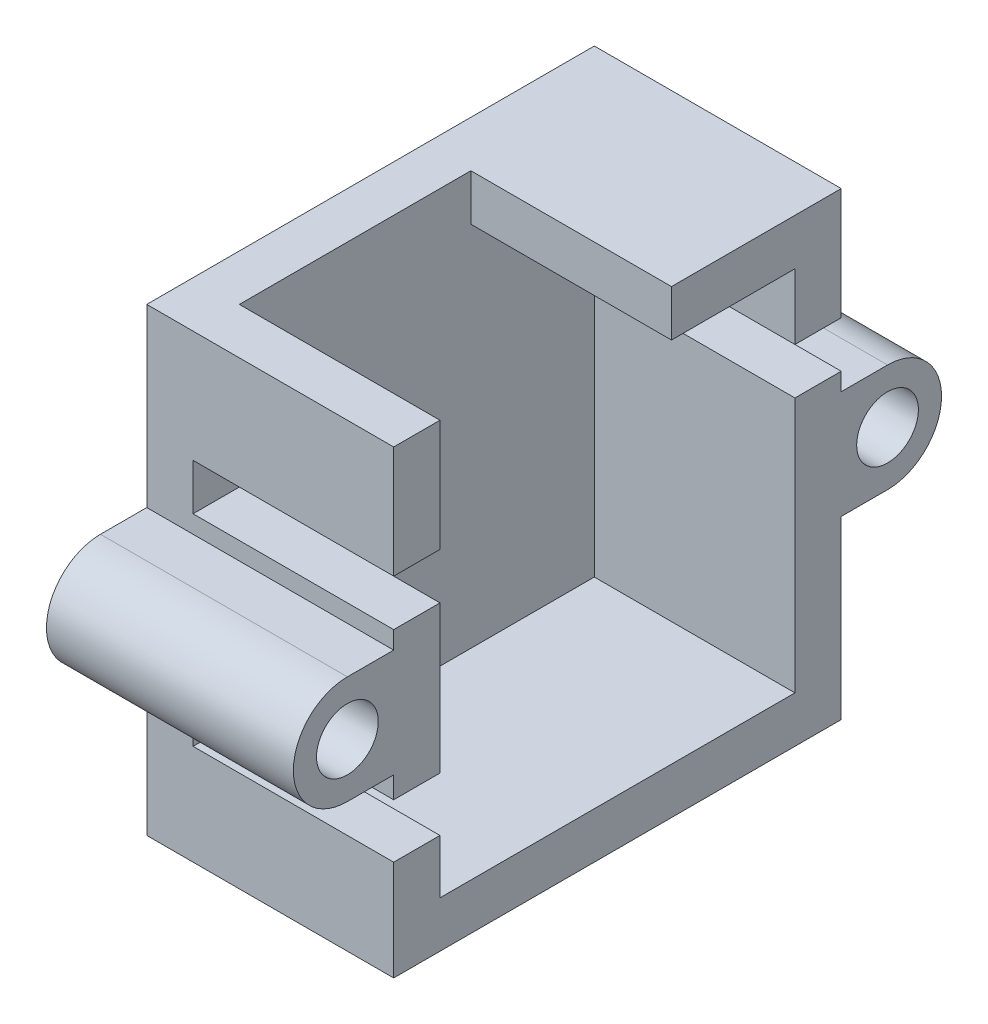
from build123d import *

# Parameters (mm, degrees)
SKETCH1_W                = 29
SKETCH1_H                = 29.8
SKETCH1_W_2              = 23
SKETCH1_H_2              = 23.8
SIDES_DEPTH              = 13
SKETCH2_W                = 29
SKETCH2_H                = 29.8
BASE_DEPTH               = 3
SKETCH3_W                = 29
SKETCH3_H                = 3
SERVO_WING_SLOTS_DEPTH   = 13
SKETCH4_W                = 3
SKETCH4_H                = 3.5
SERVO_WIRE_SLOT_DEPTH    = 13
SKETCH5_W                = 15
SKETCH5_H                = 3
SERVO_HEAD_OPENING_DEPTH = 13
MOUNT_REACH              = 41.538
SKETCH6_R                = 2
MOUNT_DIRECTION_2_REACH  = 41.538


with BuildPart() as part:
    # Sketch1 → sides (new body)
    with BuildSketch(Plane(origin=(0, 0, 0), x_dir=(0, 0, -1), z_dir=(1, 0, 0))):
        with Locations((11.5, 11.9)):
            Rectangle(SKETCH1_W, SKETCH1_H)
        with Locations((11.5, 11.9)):
            Rectangle(SKETCH1_W_2, SKETCH1_H_2, mode=Mode.SUBTRACT)
    extrude(amount=SIDES_DEPTH)

    # Sketch2 → base (add)
    with BuildSketch(Plane(origin=(0, 0, 0), x_dir=(0, 0, -1), z_dir=(1, 0, 0))):
        with Locations((11.5, 11.9)):
            Rectangle(SKETCH2_W, SKETCH2_H)
    extrude(amount=-BASE_DEPTH)

    # Sketch3 → servo wing slots (cut)
    with BuildSketch(Plane(origin=(0, 0, 0), x_dir=(0, 0, -1), z_dir=(1, 0, 0))):
        with Locations((11.5, 18.05)):
            Rectangle(SKETCH3_W, SKETCH3_H)
    extrude(amount=SERVO_WING_SLOTS_DEPTH, mode=Mode.SUBTRACT)

    # Sketch4 → servo wire slot (cut)
    with BuildSketch(Plane(origin=(0, 0, 0), x_dir=(0, 0, -1), z_dir=(1, 0, 0))):
        with Locations((-1.5, 5.25)):
            Rectangle(SKETCH4_W, SKETCH4_H)
    extrude(amount=SERVO_WIRE_SLOT_DEPTH, mode=Mode.SUBTRACT)

    # Sketch5 → servo head opening (cut)
    with BuildSketch(Plane(origin=(0, 0, 0), x_dir=(0, 0, -1), z_dir=(1, 0, 0))):
        with Locations((7.5, 25.3)):
            Rectangle(SKETCH5_W, SKETCH5_H)
    extrude(amount=SERVO_HEAD_OPENING_DEPTH, mode=Mode.SUBTRACT)

    # mount: up to this face of the body (flat: up to its plane)
    mount_end = Plane(part.part.faces().sort_by_distance((13, 11.775, 1.5))[0])
    # Sketch6 → mount (add, up to the picked face)
    with BuildSketch(Plane(origin=(0, 0, 0), x_dir=(0, 0, -1), z_dir=(1, 0, 0)), mode=Mode.PRIVATE) as mount_sk1:
        with BuildLine():
            Line((-6, 15.4), (-3, 15.4))
            Line((-3, 15.4), (-3, 8.4))
            Line((-3, 8.4), (-6, 8.4))
            ThreePointArc((-6, 8.4), (-9.5, 11.9), (-6, 15.4))
        make_face()
        with Locations(Location((-6, 11.9, 0), (0, 0, 180))):
            Circle(SKETCH6_R, mode=Mode.SUBTRACT)
    mount_tool1 = split(extrude(mount_sk1.sketch, amount=MOUNT_REACH, mode=Mode.PRIVATE), bisect_by=mount_end, keep=Keep.BOTH, mode=Mode.PRIVATE)
    # Sketch6 → mount (add, up to the picked face)
    with BuildSketch(Plane(origin=(0, 0, 0), x_dir=(0, 0, -1), z_dir=(1, 0, 0)), mode=Mode.PRIVATE) as mount_sk2:
        with BuildLine():
            Line((29, 15.4), (26, 15.4))
            Line((26, 15.4), (26, 8.4))
            Line((26, 8.4), (29, 8.4))
            ThreePointArc((29, 8.4), (32.5, 11.9), (29, 15.4))
        make_face()
        with Locations(Location((29, 11.9, 0), (0, 0, 180))):
            Circle(SKETCH6_R, mode=Mode.SUBTRACT)
    mount_tool2 = split(extrude(mount_sk2.sketch, amount=MOUNT_REACH, mode=Mode.PRIVATE), bisect_by=mount_end, keep=Keep.BOTH, mode=Mode.PRIVATE)
    add(mount_tool1.solids().sort_by(Axis((0, 15.304475, 4.5), (1, 0, 0)))[0])
    add(mount_tool2.solids().sort_by(Axis((0, 11.9, -32.404475), (1, 0, 0)))[0])

    # mount direction 2: up to this face of the body (flat: up to its plane)
    mount_direction_2_end = Plane(part.part.faces().sort_by_distance((-3, 11.9, -11.5))[0])
    # Sketch6 → mount direction 2 (add, up to the picked face)
    with BuildSketch(Plane(origin=(0, 0, 0), x_dir=(0, 0, -1), z_dir=(1, 0, 0)), mode=Mode.PRIVATE) as mount_direction_2_sk1:
        with BuildLine():
            Line((-6, 15.4), (-3, 15.4))
            Line((-3, 15.4), (-3, 8.4))
            Line((-3, 8.4), (-6, 8.4))
            ThreePointArc((-6, 8.4), (-9.5, 11.9), (-6, 15.4))
        make_face()
        with Locations(Location((-6, 11.9, 0), (0, 0, 180))):
            Circle(SKETCH6_R, mode=Mode.SUBTRACT)
    mount_direction_2_tool1 = split(extrude(mount_direction_2_sk1.sketch, amount=-MOUNT_DIRECTION_2_REACH, mode=Mode.PRIVATE), bisect_by=mount_direction_2_end, keep=Keep.BOTH, mode=Mode.PRIVATE)
    # Sketch6 → mount direction 2 (add, up to the picked face)
    with BuildSketch(Plane(origin=(0, 0, 0), x_dir=(0, 0, -1), z_dir=(1, 0, 0)), mode=Mode.PRIVATE) as mount_direction_2_sk2:
        with BuildLine():
            Line((29, 15.4), (26, 15.4))
            Line((26, 15.4), (26, 8.4))
            Line((26, 8.4), (29, 8.4))
            ThreePointArc((29, 8.4), (32.5, 11.9), (29, 15.4))
        make_face()
        with Locations(Location((29, 11.9, 0), (0, 0, 180))):
            Circle(SKETCH6_R, mode=Mode.SUBTRACT)
    mount_direction_2_tool2 = split(extrude(mount_direction_2_sk2.sketch, amount=-MOUNT_DIRECTION_2_REACH, mode=Mode.PRIVATE), bisect_by=mount_direction_2_end, keep=Keep.BOTH, mode=Mode.PRIVATE)
    add(mount_direction_2_tool1.solids().sort_by(Axis((0, 15.304475, 4.5), (-1, 0, 0)))[0])
    add(mount_direction_2_tool2.solids().sort_by(Axis((0, 11.9, -32.404475), (-1, 0, 0)))[0])


solid = part.part
